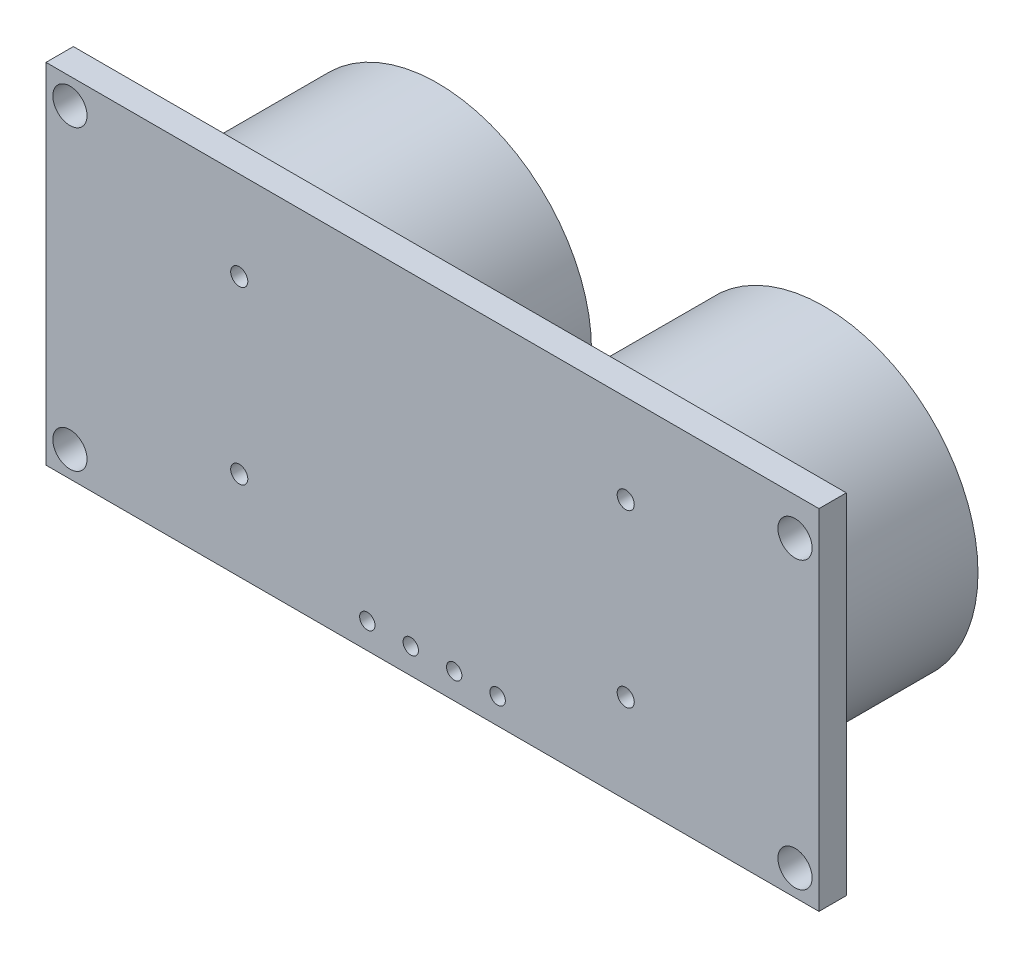
from build123d import *

# Parameters (mm, degrees)
SKETCH_1_W          = 45.2
SKETCH_1_H          = 20.4
EXTRUDE_1_DEPTH     = 1.6
SKETCH_2_R          = 1
SKETCH_2_R_2        = 0.45
CUT_EXTRUDE_1_DEPTH = 25.846730167
SKETCH_3_R          = 0.5
CUT_EXTRUDE_2_DEPTH = 25.846730167
SKETCH_4_R          = 9
EXTRUDE_2_DEPTH     = 10


with BuildPart() as part:
    # Эскиз1 → Бобышка-Вытянуть1 (new body)
    with BuildSketch(Plane.XY):
        Rectangle(SKETCH_1_W, SKETCH_1_H)
    extrude(amount=EXTRUDE_1_DEPTH)

    # Эскиз2 → Вырез-Вытянуть1 (cut, through all)
    with BuildSketch(Plane.XY.offset(1.6)):
        with Locations((-21.2, 8.7)):
            Circle(SKETCH_2_R)
        with Locations((-21.2, -8.7)):
            Circle(SKETCH_2_R)
        with Locations((21.2, -8.7)):
            Circle(SKETCH_2_R)
        with Locations((21.2, 8)):
            Circle(SKETCH_2_R)
        with Locations((-3.81, -8.7)):
            Circle(SKETCH_2_R_2)
        with Locations((-1.27, -8.7)):
            Circle(SKETCH_2_R_2)
        with Locations((1.27, -8.7)):
            Circle(SKETCH_2_R_2)
        with Locations((3.81, -8.7)):
            Circle(SKETCH_2_R_2)
    extrude(amount=-CUT_EXTRUDE_1_DEPTH, mode=Mode.SUBTRACT)

    # Эскиз3 → Вырез-Вытянуть2 (cut, through all)
    with BuildSketch(Plane.XY.offset(1.6)):
        with Locations((11.3, 5)):
            Circle(SKETCH_3_R)
        with Locations((11.3, -5)):
            Circle(SKETCH_3_R)
        with Locations(Location((-11.3, -5, 0), (0, 0, 180))):
            Circle(SKETCH_3_R)
        with Locations(Location((-11.3, 5, 0), (0, 0, 180))):
            Circle(SKETCH_3_R)
    extrude(amount=-CUT_EXTRUDE_2_DEPTH, mode=Mode.SUBTRACT)

    # Эскиз4 → Бобышка-Вытянуть2 (add)
    with BuildSketch(Plane(origin=(0, 0, 0), x_dir=(-1, 0, 0), z_dir=(0, 0, -1))):
        with Locations(Location((-11.3, 0, 0), (0, 0, 180))):
            Circle(SKETCH_4_R)
        with Locations(Location((11.3, 0, 0), (0, 0, 180))):
            Circle(SKETCH_4_R)
    extrude(amount=EXTRUDE_2_DEPTH)


solid = part.part
